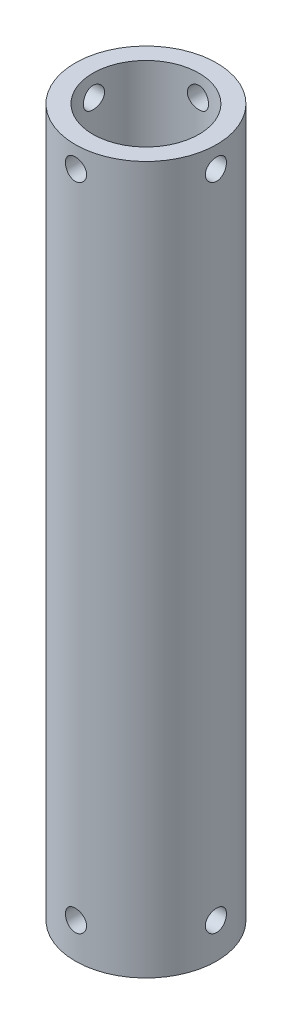
from build123d import *

# Parameters (mm, degrees)
SKETCH1_R         = 12.7
SKETCH1_R_2       = 9.525
ELTUBO_DEPTH      = 127
SETSCREW_REACH    = 132.136
SETSCREW_BORE_R   = 1.89865
CIRPATTERN1_COUNT = 4


with BuildPart() as part:
    # Sketch1 → ElTubo (new body)
    with BuildSketch(Plane(origin=(0, 0, 0), x_dir=(1, 0, 0), z_dir=(0, 1, 0))):
        with Locations(Location((0, 0, 0), (0, 0, 270))):
            Circle(SKETCH1_R)
        with Locations(Location((0, 0, 0), (0, 0, 270))):
            Circle(SKETCH1_R_2, mode=Mode.SUBTRACT)
    extrude(amount=ELTUBO_DEPTH)

    # SetScrew bore → SetScrew (cut, up to next)
    with BuildSketch(Plane.ZY.offset(12.7), mode=Mode.PRIVATE) as setscrew_sk1:
        with Locations((0, 6.35)):
            Circle(SETSCREW_BORE_R)
    setscrew_tool1 = extrude(setscrew_sk1.sketch, amount=-SETSCREW_REACH, mode=Mode.PRIVATE) & part.part
    # SetScrew bore → SetScrew (cut, up to next)
    with BuildSketch(Plane.ZY.offset(12.7), mode=Mode.PRIVATE) as setscrew_sk2:
        with Locations((0, 123.19)):
            Circle(SETSCREW_BORE_R)
    setscrew_tool2 = extrude(setscrew_sk2.sketch, amount=-SETSCREW_REACH, mode=Mode.PRIVATE) & part.part
    setscrew_1 = setscrew_tool1.solids().sort_by_distance((-12.7, 6.35, 0))[0]
    add(setscrew_1, mode=Mode.SUBTRACT)
    setscrew_2 = setscrew_tool2.solids().sort_by_distance((-12.7, 123.19, 0))[0]
    add(setscrew_2, mode=Mode.SUBTRACT)
    setscrew = setscrew_1 + setscrew_2  # SetScrew as one shape, for the pattern or mirror that repeats it

    # CirPattern1: SetScrew ×4 about axis
    cirpattern1_axis = Axis((0, 127, 0), (0, -1, 0))
    for i in range(1, CIRPATTERN1_COUNT):
        add(setscrew.rotate(cirpattern1_axis, i * 360 / CIRPATTERN1_COUNT), mode=Mode.SUBTRACT)


solid = part.part
